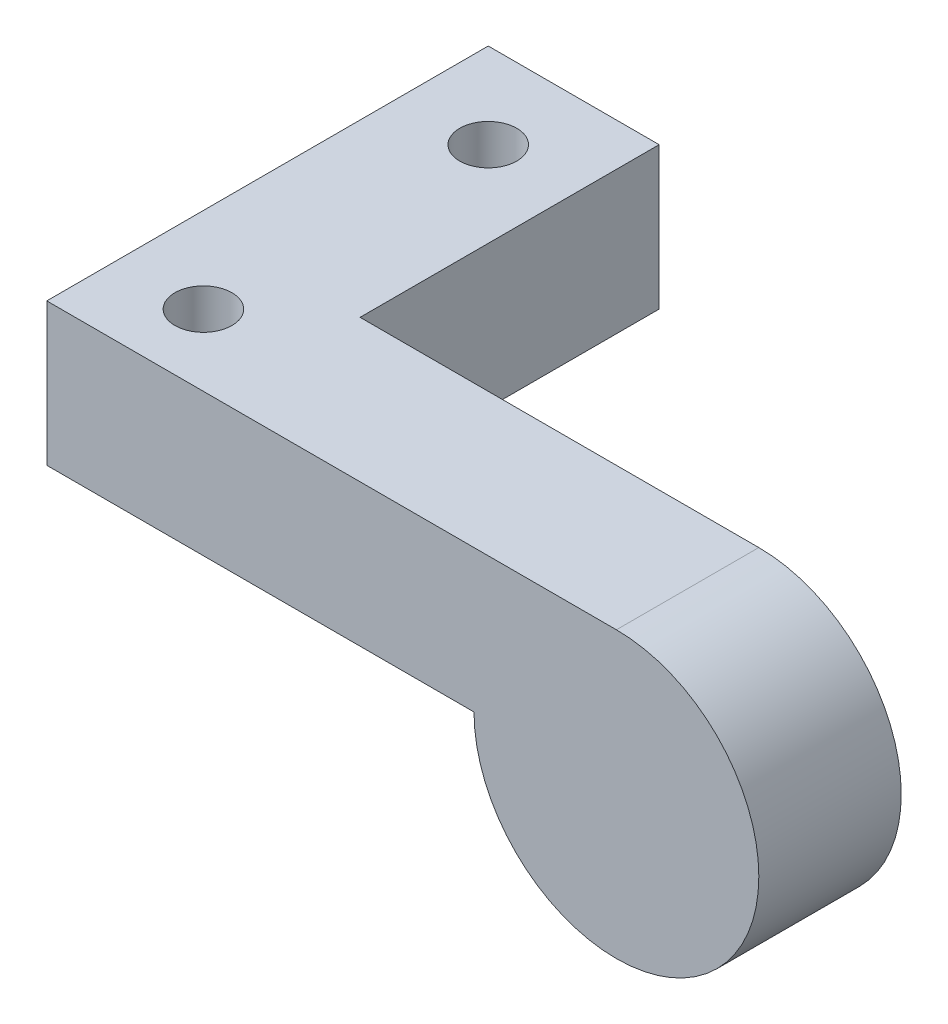
from build123d import *

# Parameters (mm, degrees)
SKETCH_1_R               = 5
SKETCH_1_R_2             = 2.5
EXTRUDE_1_DEPTH          = 3
SKETCH_2_R               = 5
EXTRUDE_2_DEPTH          = 2
EXTRUDE_3_DEPTH          = 5
SKETCH_6_R               = 1
CUT_EXTRUDE_2_DEPTH      = 10
SKETCH_7_W               = 6
SKETCH_7_H               = 10
EXTRUDE_5_DEPTH          = 10.5
SKETCH_8_R               = 1
CUT_EXTRUDE_3_DEPTH      = 12
CUT_EXTRUDE_4_DEPTH      = 24.135470603
CUT_EXTRUDE_4_DEPTH_BACK = 24.135470603


with BuildPart() as part:
    # 草图1 → 凸台-拉伸1 (new body)
    with BuildSketch(Plane.XY):
        Circle(SKETCH_1_R)
        Circle(SKETCH_1_R_2, mode=Mode.SUBTRACT)
    extrude(amount=EXTRUDE_1_DEPTH)

    # 草图2 → 凸台-拉伸2 (add)
    with BuildSketch(Plane.XY.offset(3)):
        Circle(SKETCH_2_R)
    extrude(amount=EXTRUDE_2_DEPTH)

    # 草图3 → 凸台-拉伸3 (add)
    with BuildSketch(Plane(origin=(0, 0, 0), x_dir=(-1, 0, 0), z_dir=(0, 0, -1))):
        with BuildLine():
            Line((0, 5), (20, 5))
            Line((20, 5), (20, -5))
            Line((20, -5), (0, -5))
            ThreePointArc((0, -5), (5, 0), (0, 5))
        make_face()
    extrude(amount=-EXTRUDE_3_DEPTH)

    # 草图6 → 切除-拉伸2 (cut)
    with BuildSketch(Plane(origin=(0, 5, 0), x_dir=(1, 0, 0), z_dir=(0, 1, 0))):
        with Locations(Location((-17, -2.5, 0), (0, 0, 270))):
            Circle(SKETCH_6_R)
    extrude(amount=-CUT_EXTRUDE_2_DEPTH, mode=Mode.SUBTRACT)

    # 草图7 → 凸台-拉伸5 (add)
    with BuildSketch(Plane(origin=(0, 0, 0), x_dir=(-1, 0, 0), z_dir=(0, 0, -1))):
        with Locations((17, 0)):
            Rectangle(SKETCH_7_W, SKETCH_7_H)
    extrude(amount=EXTRUDE_5_DEPTH)

    # 草图8 → 切除-拉伸3 (cut)
    with BuildSketch(Plane(origin=(0, 5, 0), x_dir=(1, 0, 0), z_dir=(0, 1, 0))):
        with Locations(Location((-17, 7.5, 0), (0, 0, 270))):
            Circle(SKETCH_8_R)
    extrude(amount=-CUT_EXTRUDE_3_DEPTH, mode=Mode.SUBTRACT)

    # 草图9 → 切除-拉伸4 (cut, two sides: drawn at the far end of the back side and taken through both)
    with BuildSketch(Plane(origin=(0, 0, 0), x_dir=(-1, 0, 0), z_dir=(0, 0, -1)).offset(-CUT_EXTRUDE_4_DEPTH_BACK)):
        with BuildLine():
            Line((5, 0), (20, 0))
            Line((20, 0), (20, -5))
            Line((20, -5), (0, -5))
            ThreePointArc((0, -5), (3.535533906, -3.535533906), (5, 0))
        make_face()
    extrude(amount=CUT_EXTRUDE_4_DEPTH + CUT_EXTRUDE_4_DEPTH_BACK, mode=Mode.SUBTRACT)


solid = part.part
